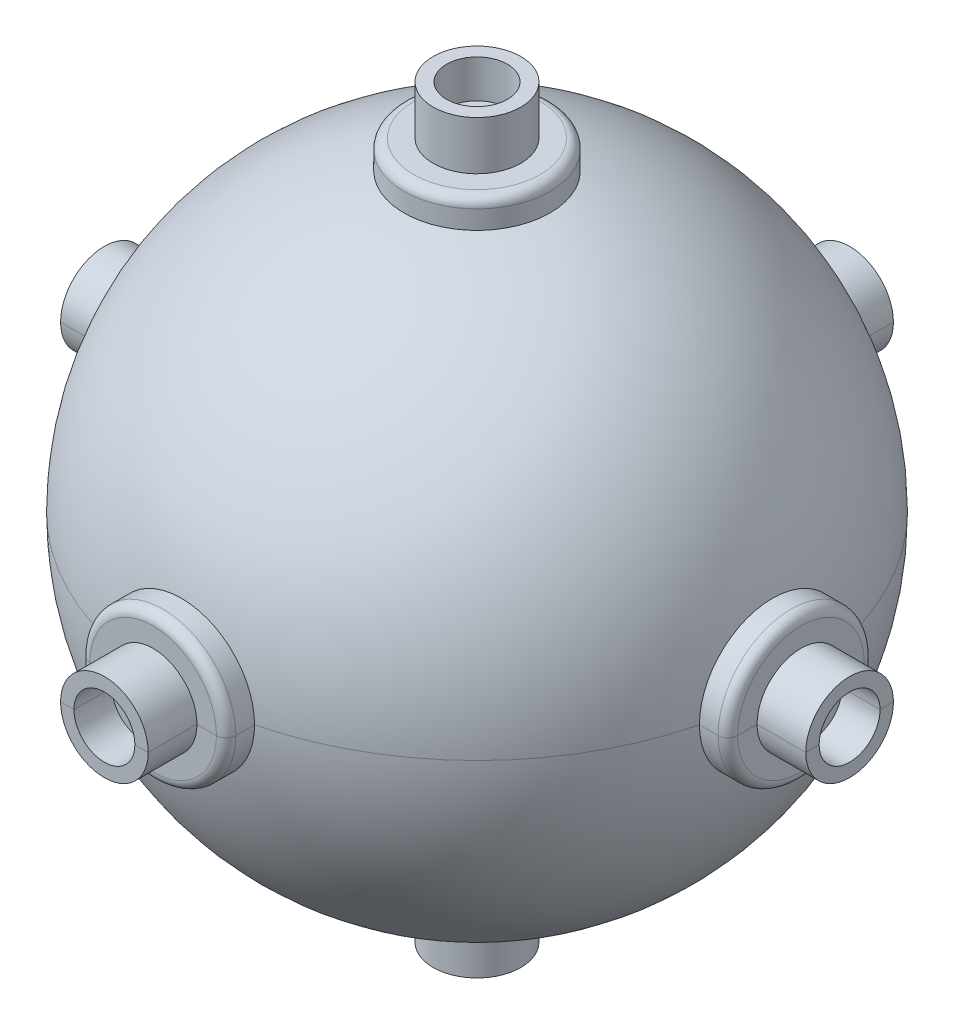
from build123d import *

# Parameters (mm, degrees)
SKETCH6_R           = 3.81
BOSS_EXTRUDE1_DEPTH = 1.016
SKETCH9_R           = 2.286
BOSS_EXTRUDE3_DEPTH = 2.54
CIRPATTERN1_COUNT   = 4
SKETCH10_R          = 3.81
BOSS_EXTRUDE4_DEPTH = 1.016
SKETCH11_R          = 2.286
BOSS_EXTRUDE5_DEPTH = 2.54
CIRPATTERN2_COUNT   = 4
FILLET1_R           = 0.508


with BuildPart() as part:
    # Sketch1 → Revolve1 (revolve)
    with BuildSketch(Plane.XY):
        with BuildLine():
            Line((0, 15.875), (0, -15.875))
            ThreePointArc((0, -15.875), (-15.875, 0), (0, 15.875))
        make_face()
    revolve(axis=Axis((0, 15.875, 0), (0, -1, 0)))

    # Sketch6 → Boss-Extrude1 (add, symmetric)
    with BuildSketch(Plane.XY.offset(15.875)):
        with Locations(Location((0, 0, 0), (0, 0, 180))):
            Circle(SKETCH6_R)
    boss_extrude1 = extrude(amount=BOSS_EXTRUDE1_DEPTH, both=True)

    # Sketch9 → Boss-Extrude3 (add)
    with BuildSketch(Plane.XY.offset(16.891)):
        Circle(SKETCH9_R)
    boss_extrude3 = extrude(amount=BOSS_EXTRUDE3_DEPTH)

    # CirPattern1: Boss-Extrude1, Boss-Extrude3 ×4 about axis
    cirpattern1_axis = Axis((0, 0, 0), (0, 1, 0))
    add([boss_extrude1.rotate(cirpattern1_axis, i * 360 / CIRPATTERN1_COUNT) for i in range(1, CIRPATTERN1_COUNT)])
    add([boss_extrude3.rotate(cirpattern1_axis, i * 360 / CIRPATTERN1_COUNT) for i in range(1, CIRPATTERN1_COUNT)])

    # Sketch10 → Boss-Extrude4 (add, symmetric)
    with BuildSketch(Plane(origin=(0, 15.875, 0), x_dir=(1, 0, 0), z_dir=(0, 1, 0))):
        with Locations(Location((0, 0, 0), (0, 0, 90))):
            Circle(SKETCH10_R)
    boss_extrude4 = extrude(amount=BOSS_EXTRUDE4_DEPTH, both=True)

    # Sketch11 → Boss-Extrude5 (add)
    with BuildSketch(Plane(origin=(0, 16.891, 0), x_dir=(1, 0, 0), z_dir=(0, 1, 0))):
        with Locations(Location((0, 0, 0), (0, 0, 270))):
            Circle(SKETCH11_R)
    boss_extrude5 = extrude(amount=BOSS_EXTRUDE5_DEPTH)

    # Mirror1: Boss-Extrude4, Boss-Extrude5 across plane
    add(boss_extrude4.mirror(Plane.ZX))
    add(boss_extrude5.mirror(Plane.ZX))

    # Sketch13 → CBORE for _00 Binding Head Machine Screw (revolve, cut)
    with BuildSketch(Plane(origin=(0, 19.431, 0), x_dir=(0, 0, 1), z_dir=(1, 0, 0))):
        Polygon((0, 0), (0, 4.229701142), (0.6985, 3.81), (0.6985, 1.9812), (1.5875, 1.9812), (1.5875, 0), align=None)
    cbore_for_00_binding_head_machine_screw = revolve(axis=Axis((0, 25.781, 0), (0, -1, 0)), mode=Mode.SUBTRACT)

    # CirPattern2: CBORE for _00 Binding Head Machine Screw ×4 about axis
    cirpattern2_axis = Axis((0, 0, 0), (1, 0, 0))
    for i in range(1, CIRPATTERN2_COUNT):
        add(cbore_for_00_binding_head_machine_screw.rotate(cirpattern2_axis, i * 360 / CIRPATTERN2_COUNT), mode=Mode.SUBTRACT)

    # Sketch19 → CBORE for _00 Binding Head Machine S 2 (revolve, cut)
    with BuildSketch(Plane(origin=(19.431, 0, 0), x_dir=(0, 0, -1), z_dir=(0, 1, 0))):
        Polygon((0, 0), (0, 4.229701142), (0.6985, 3.81), (0.6985, 1.9812), (1.5875, 1.9812), (1.5875, 0), align=None)
    cbore_for_00_binding_head_machine_s_2 = revolve(axis=Axis((25.781, 0, 0), (-1, 0, 0)), mode=Mode.SUBTRACT)

    # Mirror2: CBORE for _00 Binding Head Machine S 2 across plane
    add(cbore_for_00_binding_head_machine_s_2.mirror(Plane(origin=(0, 0, 0), x_dir=(0, 0, 1), z_dir=(1, 0, 0))), mode=Mode.SUBTRACT)

    # Fillet1
    fillet1_edges = [part.edges().sort_by_distance(p)[0] for p in [
        (-16.891, 0, 3.81),
        (-3.81, 0, -16.891),
        (16.891, 0, -3.81),
        (0, 16.891, 3.81),
        (0, -16.891, 3.81),
        (3.81, 0, 16.891),
    ]]
    fillet(fillet1_edges, radius=FILLET1_R)


with BuildPart() as body_2:
    # Split1: the piece on the far side of the plane
    add(part.part)
    split(bisect_by=Plane.ZX, keep=Keep.BOTTOM)


with BuildPart() as part_1:
    add(part.part)

    # Split1
    split(bisect_by=Plane.ZX, keep=Keep.TOP)


solid = Compound([body_2.part, part_1.part])
